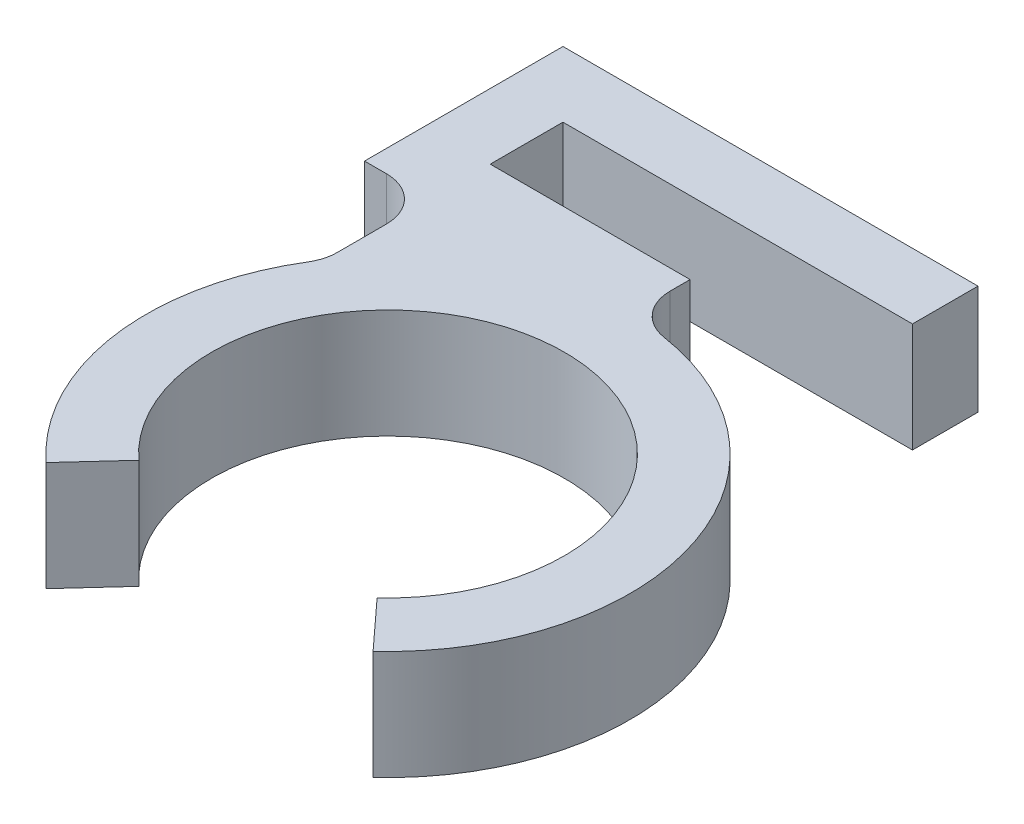
from build123d import *

# Parameters (mm, degrees)
BOSS_EXTRUDE1_DEPTH = 5


with BuildPart() as part:
    # Sketch1 → Boss-Extrude1 (new body)
    with BuildSketch(Plane(origin=(0, 0, 0), x_dir=(1, 0, 0), z_dir=(0, 1, 0))):
        with BuildLine():
            Line((4.667838451, -28.325346505), (6.694609074, -26.113514495))
            ThreePointArc((6.694609074, -26.113514495), (12.15, -12.085), (17.605390926, -26.113514495))
            Line((17.605390926, -26.113514495), (19.632161549, -28.325346505))
            ThreePointArc((19.632161549, -28.325346505), (22.749479973, -16.949602936), (13.844072658, -9.215332676))
            ThreePointArc((13.844072658, -9.215332676), (12.631471982, -8.540434515), (12.15, -7.238869051))
            Line((12.15, -7.238869051), (12.15, -6.33))
            Line((12.15, -6.33), (3, -6.33))
            Line((3, -6.33), (3, -3))
            Line((3, -3), (19, -3))
            Line((19, -3), (19, 0))
            Line((19, 0), (0, 0))
            Line((0, 0), (0, -9.085))
            Line((0, -9.085), (1, -9.085))
            ThreePointArc((1, -9.085), (2.414213562, -9.670786438), (3, -11.085))
            Line((3, -11.085), (3, -13.331154929))
            ThreePointArc((3, -13.331154929), (2.924979203, -13.87379207), (2.705544933, -14.375720141))
            ThreePointArc((2.705544933, -14.375720141), (1.182976409, -21.702730876), (4.667838451, -28.325346505))
        make_face()
    extrude(amount=BOSS_EXTRUDE1_DEPTH)


solid = part.part
